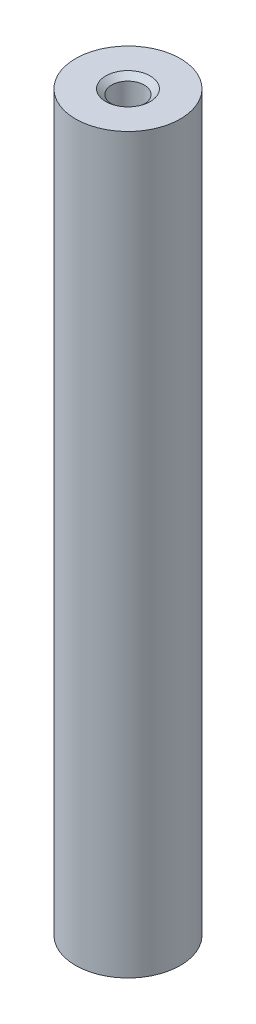
from build123d import *

# Parameters (mm, degrees)
SKETCH1_R                         = 12.7
BOSS_EXTRUDE1_DEPTH               = 177.8
F_1_2_13_TAPPED_HOLE1_D           = 10.71626
F_1_2_13_TAPPED_HOLE1_DEPTH       = 25.4
F_1_2_13_TAPPED_HOLE1_CSINK_D     = 13.97
F_1_2_13_TAPPED_HOLE1_CSINK_ANGLE = 100
F_1_2_13_TAPPED_HOLE1_TIP         = 3.219489309
F_3_8_16_TAPPED_HOLE1_D           = 7.9375
F_3_8_16_TAPPED_HOLE1_DEPTH       = 25.4
F_3_8_16_TAPPED_HOLE1_CSINK_D     = 10.795
F_3_8_16_TAPPED_HOLE1_CSINK_ANGLE = 100
F_3_8_16_TAPPED_HOLE1_TIP         = 2.384665582


with BuildPart() as part:
    # Sketch1 → Boss-Extrude1 (new body)
    with BuildSketch(Plane(origin=(0, 0, 0), x_dir=(1, 0, 0), z_dir=(0, 1, 0))):
        with Locations(Location((0, 0, 0), (0, 0, 270))):
            Circle(SKETCH1_R)
    extrude(amount=BOSS_EXTRUDE1_DEPTH)

    # 1/2-13 Tapped Hole1
    with Locations(Plane(origin=(0, 0, 0), x_dir=(-1, 0, 0), z_dir=(0, -1, 0))):
        with Locations((0, 0)):
            CounterSinkHole(F_1_2_13_TAPPED_HOLE1_D / 2, F_1_2_13_TAPPED_HOLE1_CSINK_D / 2, depth=F_1_2_13_TAPPED_HOLE1_DEPTH, counter_sink_angle=F_1_2_13_TAPPED_HOLE1_CSINK_ANGLE)
            with Locations((0, 0, -(F_1_2_13_TAPPED_HOLE1_DEPTH + F_1_2_13_TAPPED_HOLE1_TIP / 2))):  # 118° drill point
                Cone(0, F_1_2_13_TAPPED_HOLE1_D / 2, F_1_2_13_TAPPED_HOLE1_TIP, mode=Mode.SUBTRACT)

    # 3/8-16 Tapped Hole1
    with Locations(Plane(origin=(0, 177.8, 0), x_dir=(1, 0, 0), z_dir=(0, 1, 0))):
        with Locations((0, 0)):
            CounterSinkHole(F_3_8_16_TAPPED_HOLE1_D / 2, F_3_8_16_TAPPED_HOLE1_CSINK_D / 2, depth=F_3_8_16_TAPPED_HOLE1_DEPTH, counter_sink_angle=F_3_8_16_TAPPED_HOLE1_CSINK_ANGLE)
            with Locations((0, 0, -(F_3_8_16_TAPPED_HOLE1_DEPTH + F_3_8_16_TAPPED_HOLE1_TIP / 2))):  # 118° drill point
                Cone(0, F_3_8_16_TAPPED_HOLE1_D / 2, F_3_8_16_TAPPED_HOLE1_TIP, mode=Mode.SUBTRACT)


solid = part.part
